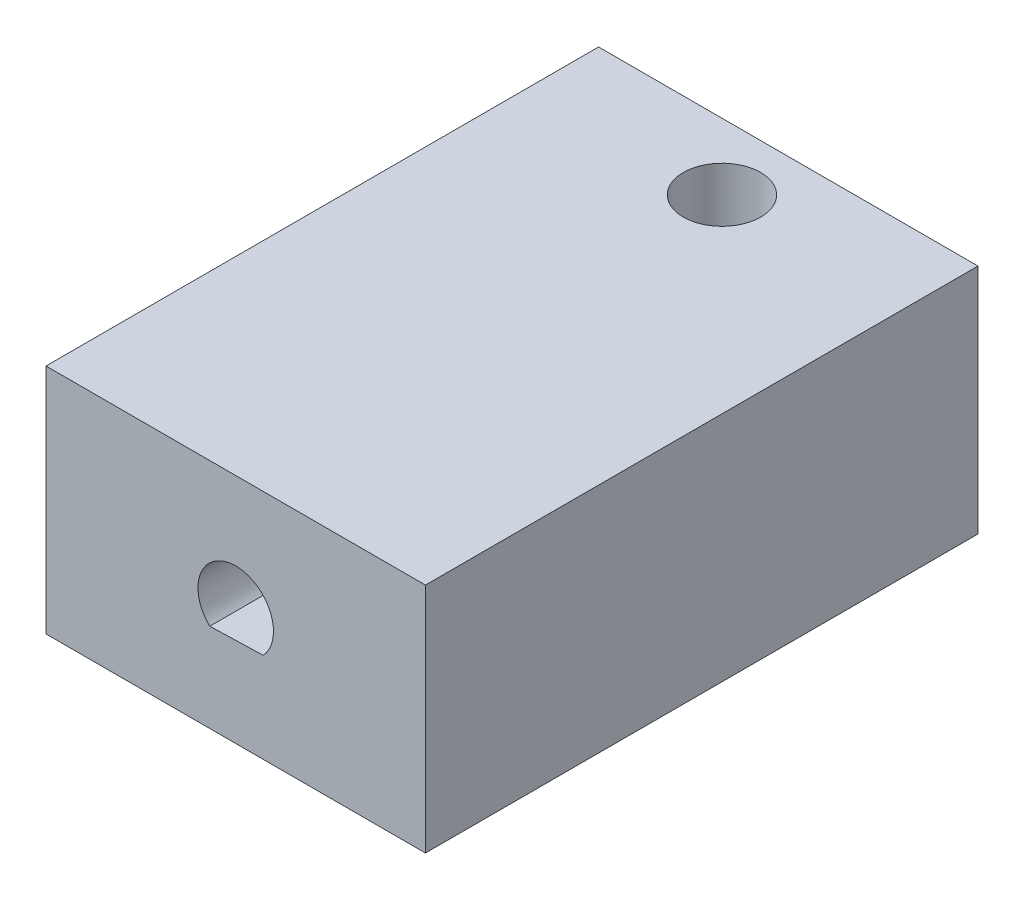
from build123d import *

# Parameters (mm, degrees)
SKETCH_2_W          = 20.6
SKETCH_2_H          = 12.6
EXTRUDE_1_DEPTH     = 30
CUT_EXTRUDE_1_DEPTH = 30
SKETCH_4_R          = 2.1
CUT_EXTRUDE_3_DEPTH = 6
SKETCH_6_R          = 2.1
CUT_EXTRUDE_4_DEPTH = 30


with BuildPart() as part:
    # Эскиз2 → Бобышка-Вытянуть1 (new body)
    with BuildSketch(Plane.XY):
        Rectangle(SKETCH_2_W, SKETCH_2_H)
    extrude(amount=EXTRUDE_1_DEPTH)

    # Эскиз3 → Вырез-Вытянуть1 (cut)
    with BuildSketch(Plane.XY.offset(30)):
        with BuildLine():
            Line((-1.408154236, -1.489832758), (1.488994806, -1.409040265))
            ThreePointArc((1.488994806, -1.409040265), (-0.05714592, 2.049203344), (-1.408154236, -1.489832758))
        make_face()
    extrude(amount=-CUT_EXTRUDE_1_DEPTH, mode=Mode.SUBTRACT)

    # Эскиз4 → Вырез-Вытянуть3 (cut)
    with BuildSketch(Plane.XZ.offset(6.3)):
        with Locations(Location((0, 3.6, 0), (0, 0, 270))):
            Circle(SKETCH_4_R)
    extrude(amount=-CUT_EXTRUDE_3_DEPTH, mode=Mode.SUBTRACT)

    # Эскиз6 → Вырез-Вытянуть4 (cut)
    with BuildSketch(Plane.XZ.offset(6.3)):
        with Locations(Location((0, 3.6, 0), (0, 0, 270))):
            Circle(SKETCH_6_R)
    extrude(amount=-CUT_EXTRUDE_4_DEPTH, mode=Mode.SUBTRACT)


solid = part.part
